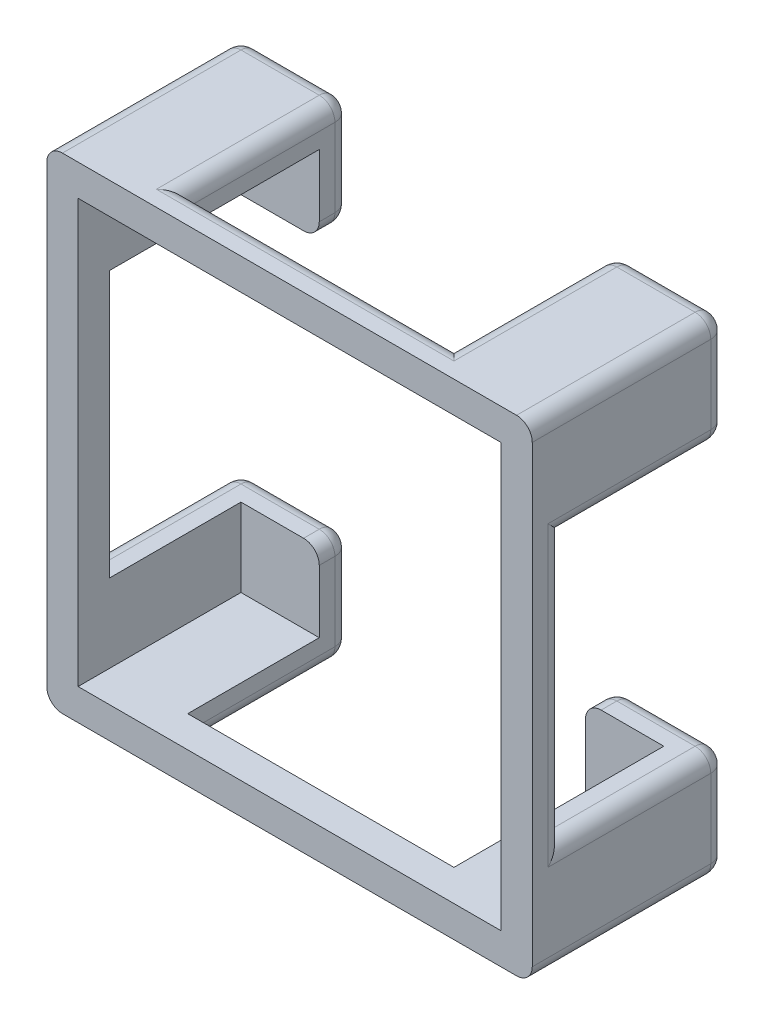
from build123d import *

# Parameters (mm, degrees)
SKETCH1_W           = 31
SKETCH1_H           = 31
SKETCH1_W_2         = 27
SKETCH1_H_2         = 27
BOSS_EXTRUDE1_DEPTH = 2
BOSS_EXTRUDE2_DEPTH = 8.4
SKETCH4_W           = 7
SKETCH4_H           = 7
BOSS_EXTRUDE3_DEPTH = 2
FILLET1_R           = 1


with BuildPart() as part:
    # Sketch1 → Boss-Extrude1 (new body)
    with BuildSketch(Plane.XY):
        with Locations((13.5, 13.5)):
            Rectangle(SKETCH1_W, SKETCH1_H)
        with Locations((13.5, 13.5)):
            Rectangle(SKETCH1_W_2, SKETCH1_H_2, mode=Mode.SUBTRACT)
    extrude(amount=BOSS_EXTRUDE1_DEPTH)

    # Sketch2 → Boss-Extrude2 (add)
    with BuildSketch(Plane(origin=(0, 0, 0), x_dir=(-1, 0, 0), z_dir=(0, 0, -1))):
        Polygon((-29, 29), (-22, 29), (-22, 27), (-27, 27), (-27, 22), (-29, 22), align=None)
        Polygon((2, 29), (-5, 29), (-5, 27), (0, 27), (0, 22), (2, 22), align=None)
        Polygon((2, 5), (2, -2), (-5, -2), (-5, 0), (0, 0), (0, 5), align=None)
        Polygon((-29, -2), (-29, 5), (-27, 5), (-27, 0), (-22, 0), (-22, -2), align=None)
    extrude(amount=BOSS_EXTRUDE2_DEPTH)

    # Sketch4 → Boss-Extrude3 (add)
    with BuildSketch(Plane(origin=(0, 0, -8.4), x_dir=(-1, 0, 0), z_dir=(0, 0, -1))):
        with Locations((-25.5, 25.5)):
            Rectangle(SKETCH4_W, SKETCH4_H)
        with Locations((-25.5, 1.5)):
            Rectangle(SKETCH4_W, SKETCH4_H)
        with Locations((-1.5, 1.5)):
            Rectangle(SKETCH4_W, SKETCH4_H)
        with Locations((-1.5, 25.5)):
            Rectangle(SKETCH4_W, SKETCH4_H)
    extrude(amount=BOSS_EXTRUDE3_DEPTH)

    # Fillet1
    fillet1_edges = [part.edges().sort_by_distance(p)[0] for p in [
        (-2, 25.5, -10.4),
        (1.5, 29, -10.4),
        (-2, 29, -4.2),
        (-2, 22, -5.2),
        (5, 5, -9.4),
        (-2, 5, -5.2),
        (-2, 13.5, 0),
        (-2, -2, -4.2),
        (5, 1.5, -10.4),
        (1.5, 5, -10.4),
        (-2, 1.5, -10.4),
        (1.5, -2, -10.4),
        (5, -2, -5.2),
        (13.5, -2, 0),
        (22, 5, -9.4),
        (22, -2, -5.2),
        (29, -2, -4.2),
        (25.5, -2, -10.4),
        (22, 22, -9.4),
        (5, 22, -9.4),
        (22, 1.5, -10.4),
        (25.5, 5, -10.4),
        (29, 1.5, -10.4),
        (29, 5, -5.2),
        (29, 13.5, 0),
        (29, 29, -4.2),
        (29, 22, -5.2),
        (29, 25.5, -10.4),
        (25.5, 22, -10.4),
        (25.5, 29, -10.4),
        (22, 25.5, -10.4),
        (22, 29, -5.2),
        (13.5, 29, 0),
        (5, 29, -5.2),
        (1.5, 22, -10.4),
        (5, 25.5, -10.4),
    ]]
    fillet(fillet1_edges, radius=FILLET1_R)


solid = part.part
